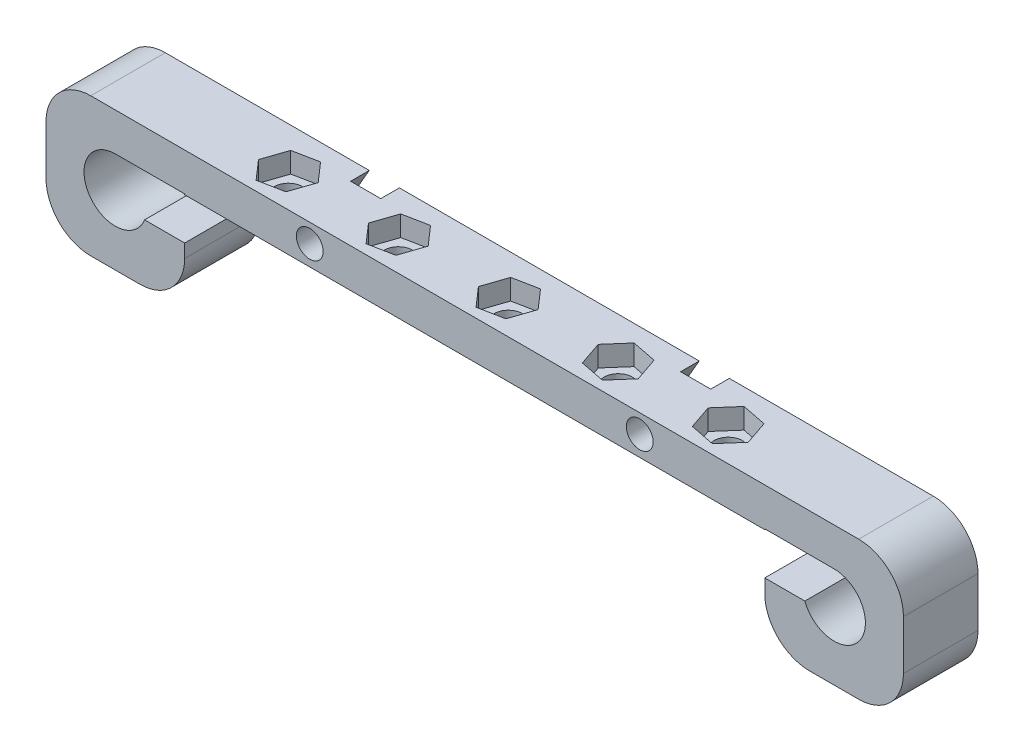
from build123d import *

# Parameters (mm, degrees)
SALIENTE_EXTRUIR1_DEPTH = 10
CROQUIS9_R              = 1.9
CORTAR_EXTRUIR5_DEPTH   = 60.926705232
CORTAR_EXTRUIR6_DEPTH   = 2.75
CROQUIS11_W             = 77.8
CROQUIS11_H             = 1.5
SALIENTE_EXTRUIR2_DEPTH = 0.2
CORTAR_EXTRUIR7_DEPTH   = 2.5
CROQUIS13_R             = 1.8
CORTAR_EXTRUIR8_DEPTH   = 59.728102302


with BuildPart() as part:
    # Croquis1 → Saliente-Extruir1 (new body)
    with BuildSketch(Plane.XY):
        with BuildLine():
            Line((51.5, 9.3), (-51.5, 9.3))
            ThreePointArc((-51.5, 9.3), (-55.742640687, 7.542640687), (-57.5, 3.3))
            Line((-57.5, 3.3), (-57.5, -3.3))
            ThreePointArc((-57.5, -3.3), (-55.742640687, -7.542640687), (-51.5, -9.3))
            Line((-51.5, -9.3), (-44.9, -9.3))
            ThreePointArc((-44.9, -9.3), (-40.657359313, -7.542640687), (-38.9, -3.3))
            Line((-38.9, -3.3), (-38.9, -1.5))
            Line((-38.9, -1.5), (-44.276990951, -1.5))
            ThreePointArc((-44.276990951, -1.5), (-51.659768778, -2.38117618), (-48.2, 4.2))
            Line((-48.2, 4.2), (-38.9, 4.2))
            Line((-38.9, 4.2), (-38.9, 4.3))
            Line((-38.9, 4.3), (38.9, 4.3))
            Line((38.9, 4.3), (38.9, 4.2))
            Line((38.9, 4.2), (48.2, 4.2))
            ThreePointArc((48.2, 4.2), (51.169848481, 2.969848481), (52.4, 0))
            ThreePointArc((52.4, 0), (48.96268014, -4.130171789), (44.276990951, -1.5))
            Line((44.276990951, -1.5), (38.9, -1.5))
            Line((38.9, -1.5), (38.9, -3.3))
            ThreePointArc((38.9, -3.3), (40.657359313, -7.542640687), (44.9, -9.3))
            Line((44.9, -9.3), (51.5, -9.3))
            ThreePointArc((51.5, -9.3), (55.742640687, -7.542640687), (57.5, -3.3))
            Line((57.5, -3.3), (57.5, 3.3))
            ThreePointArc((57.5, 3.3), (55.742640687, 7.542640687), (51.5, 9.3))
        make_face()
    extrude(amount=SALIENTE_EXTRUIR1_DEPTH)

    # Croquis9 → Cortar-Extruir5 (cut, through all)
    with BuildSketch(Plane(origin=(0, 4.3, 0), x_dir=(-1, 0, 0), z_dir=(0, -1, 0))):
        with Locations(Location((0, -5.5, 0), (0, 0, 90))):
            Circle(CROQUIS9_R)
        with Locations(Location((-29.498076211, -5.5, 0), (0, 0, 90))):
            Circle(CROQUIS9_R)
        with Locations(Location((-14.748076211, -5.5, 0), (0, 0, 90))):
            Circle(CROQUIS9_R)
        with Locations(Location((14.748076211, -5.5, 0), (0, 0, 90))):
            Circle(CROQUIS9_R)
        with Locations(Location((29.498076211, -5.5, 0), (0, 0, 90))):
            Circle(CROQUIS9_R)
    extrude(amount=-CORTAR_EXTRUIR5_DEPTH, mode=Mode.SUBTRACT)

    # Croquis10 → Cortar-Extruir6 (cut)
    with BuildSketch(Plane.XZ.offset(-9.3)):
        Polygon((1.098358677, 2.275571128), (3.341616654, 4.838992081), (2.243257977, 8.063420953), (-1.098358677, 8.724428872), (-3.341616654, 6.161007919), (-2.243257977, 2.936579047), align=None)
        Polygon((13.649717534, 2.275571128), (16.991334188, 2.936579047), (18.089692866, 6.161007919), (15.846434889, 8.724428872), (12.504818234, 8.063420953), (11.406459557, 4.838992081), align=None)
        Polygon((28.399717534, 2.275571128), (31.741334188, 2.936579047), (32.839692866, 6.161007919), (30.596434889, 8.724428872), (27.254818234, 8.063420953), (26.156459557, 4.838992081), align=None)
        Polygon((-13.649717534, 2.275571128), (-11.406459557, 4.838992081), (-12.504818234, 8.063420953), (-15.846434889, 8.724428872), (-18.089692866, 6.161007919), (-16.991334188, 2.936579047), align=None)
        Polygon((-28.399717534, 2.275571128), (-26.156459557, 4.838992081), (-27.254818234, 8.063420953), (-30.596434889, 8.724428872), (-32.839692866, 6.161007919), (-31.741334188, 2.936579047), align=None)
    extrude(amount=CORTAR_EXTRUIR6_DEPTH, mode=Mode.SUBTRACT)

    # Croquis11 → Saliente-Extruir2 (add)
    with BuildSketch(Plane.XZ.offset(-4.3)):
        with Locations((0, 9.25)):
            Rectangle(CROQUIS11_W, CROQUIS11_H)
    extrude(amount=SALIENTE_EXTRUIR2_DEPTH)

    # Croquis12 → Cortar-Extruir7 (cut)
    with BuildSketch(Plane(origin=(0, 0, 0), x_dir=(-1, 0, 0), z_dir=(0, 0, -1))):
        Polygon((25.589101615, 6.8), (23.857050808, 9.8), (20.392949192, 9.8), (18.660898385, 6.8), (20.392949192, 3.8), (23.857050808, 3.8), align=None)
        Polygon((-18.665898385, 6.8), (-20.397949192, 9.8), (-23.862050808, 9.8), (-25.594101615, 6.8), (-23.862050808, 3.8), (-20.397949192, 3.8), align=None)
    extrude(amount=-CORTAR_EXTRUIR7_DEPTH, mode=Mode.SUBTRACT)

    # Croquis13 → Cortar-Extruir8 (cut, through all)
    with BuildSketch(Plane(origin=(0, 0, 2.5), x_dir=(-1, 0, 0), z_dir=(0, 0, -1))):
        with Locations((22.125, 6.8)):
            Circle(CROQUIS13_R)
        with Locations((-22.13, 6.8)):
            Circle(CROQUIS13_R)
    extrude(amount=-CORTAR_EXTRUIR8_DEPTH, mode=Mode.SUBTRACT)


solid = part.part
